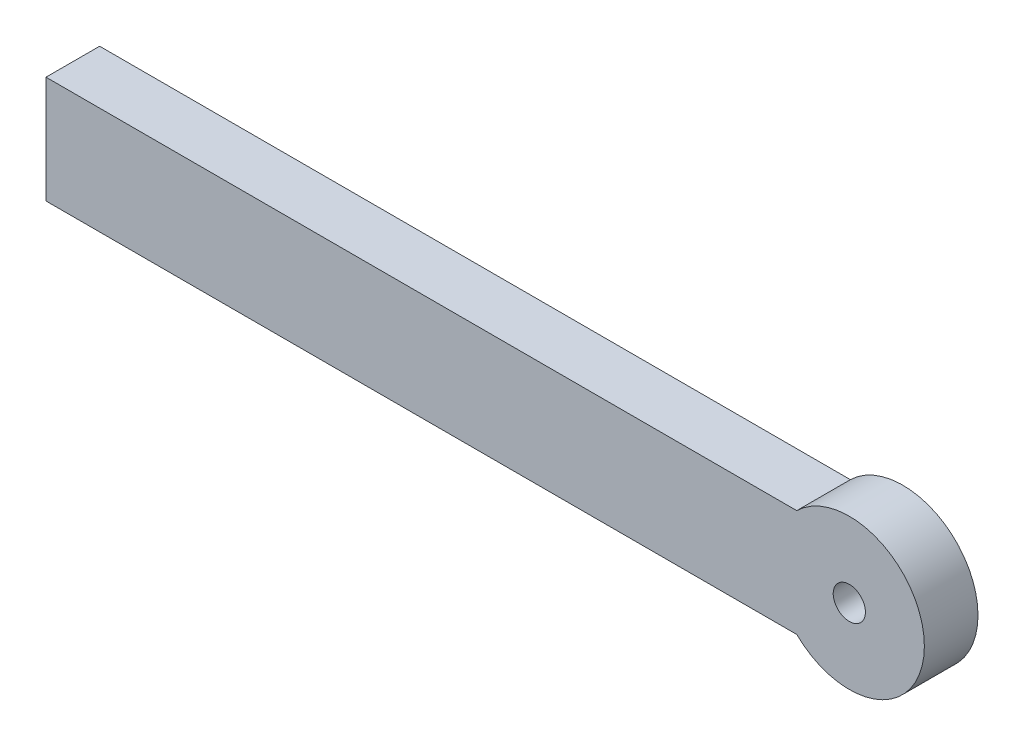
from build123d import *

# Parameters (mm, degrees)
SKETCH1_R           = 1.5
BOSS_EXTRUDE1_DEPTH = 5


with BuildPart() as part:
    # Sketch1 → Boss-Extrude1 (new body)
    with BuildSketch(Plane.XY):
        with BuildLine():
            Line((-74.898979486, 5), (-4.898979486, 5))
            ThreePointArc((-4.898979486, 5), (7, 0), (-4.898979486, -5))
            Line((-4.898979486, -5), (-74.898979486, -5))
            Line((-74.898979486, -5), (-74.898979486, 5))
        make_face()
        Circle(SKETCH1_R, mode=Mode.SUBTRACT)
    extrude(amount=BOSS_EXTRUDE1_DEPTH)


solid = part.part
